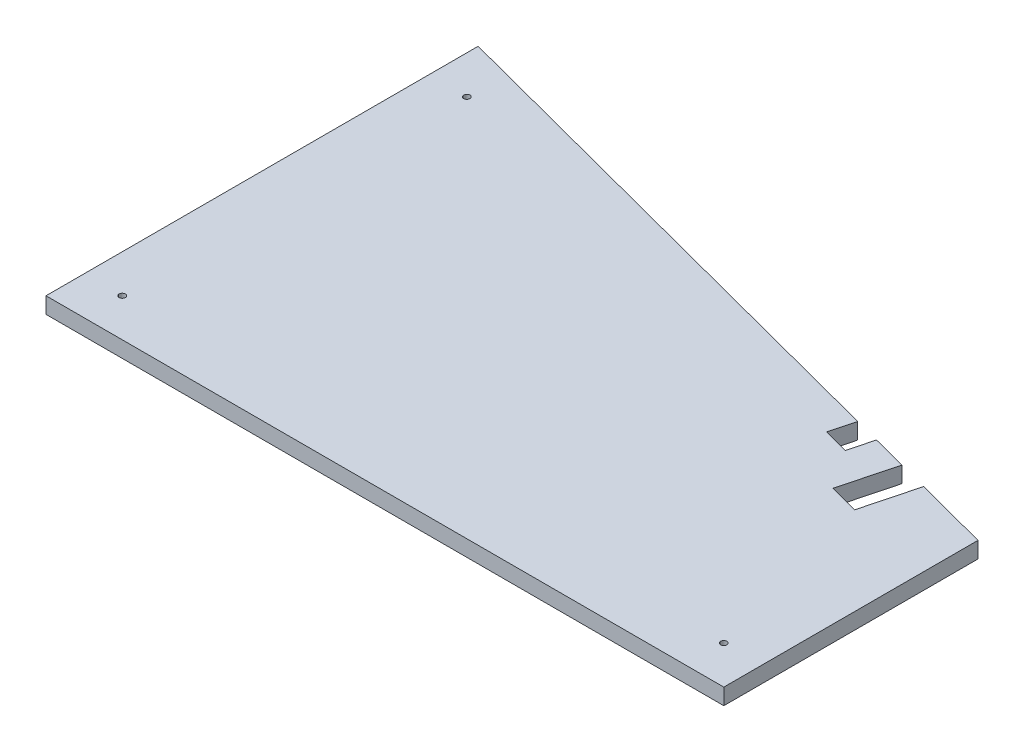
from build123d import *

# Parameters (mm, degrees)
BOSS_EXTRUDE1_DEPTH = 6.35
SKETCH3_R           = 1.225
CUT_EXTRUDE1_DEPTH  = 317.295028415


with BuildPart() as part:
    # Sketch2 → Boss-Extrude1 (new body)
    with BuildSketch(Plane(origin=(0, 0, 0), x_dir=(1, 0, 0), z_dir=(0, 1, 0))):
        Polygon((0, 0), (266.65, 0), (266.65, 100), (237.633187959, 107.617389248), (231.996319915, 86.144948337), (220.389595099, 89.191904036), (226.026463142, 110.664344947), (212.485284189, 114.219126596), (209.94615444, 104.546855915), (199.94615444, 107.172019988), (202.485284189, 116.844290668), (0, 170), align=None)
    extrude(amount=BOSS_EXTRUDE1_DEPTH)

    # Sketch3 → Cut-Extrude1 (cut, through all)
    with BuildSketch(Plane(origin=(0, 6.35, 0), x_dir=(1, 0, 0), z_dir=(0, 1, 0))):
        with Locations(Location((15, 150.554003041, 0), (0, 0, 270))):
            Circle(SKETCH3_R)
        with Locations(Location((15, 15, 0), (0, 0, 270))):
            Circle(SKETCH3_R)
        with Locations(Location((251.65, 15, 0), (0, 0, 270))):
            Circle(SKETCH3_R)
    extrude(amount=-CUT_EXTRUDE1_DEPTH, mode=Mode.SUBTRACT)


solid = part.part
